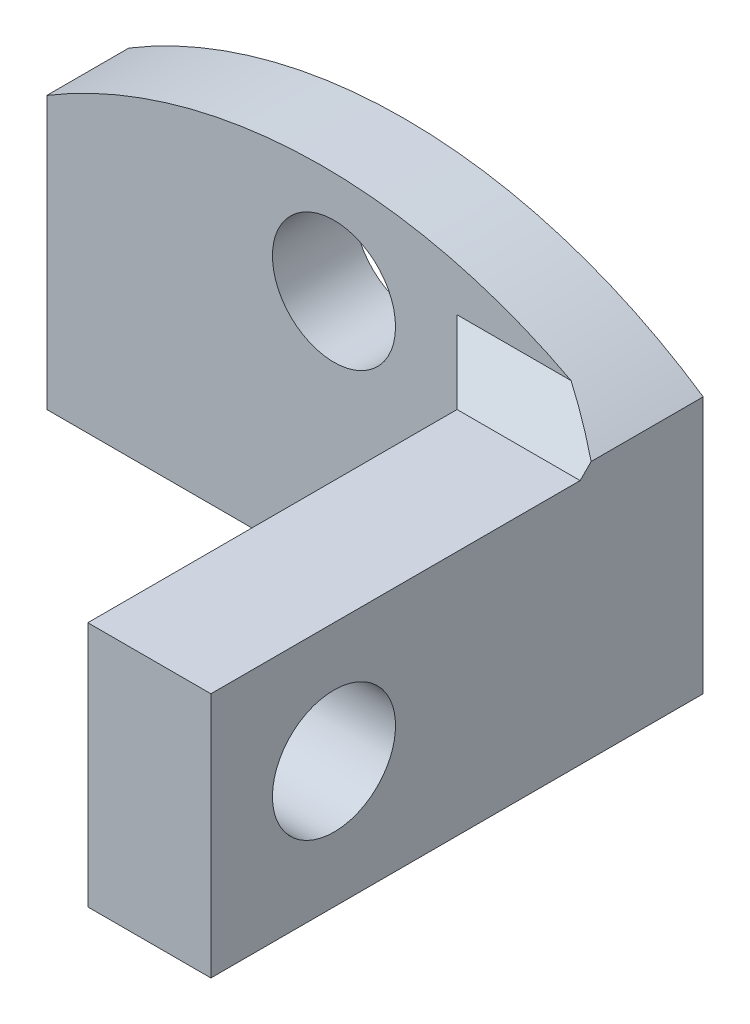
from build123d import *

# Parameters (mm, degrees)
SZKIC1_R                    = 1.5
DODANIE_WYCI_GNI_CIE1_DEPTH = 2
SZKIC2_W                    = 3
SZKIC2_H                    = 6
DODANIE_WYCI_GNI_CIE2_DEPTH = 10
SZKIC3_R                    = 1.5
WYTNIJ_WYCI_GNI_CIE1_DEPTH  = 3
SFAZOWANIE1_SIZE            = 1
SFAZOWANIE2_SIZE            = 1


with BuildPart() as part:
    # Szkic1 → Dodanie-wyciągnięcie1 (new body)
    with BuildSketch(Plane.XY):
        with BuildLine():
            Line((-6.716548808, 4.5), (7.283451192, 4.5))
            Line((7.283451192, 4.5), (7.283451192, 10.768070335))
            ThreePointArc((7.283451192, 10.768070335), (0.336426694, 12.995646082), (-6.716548808, 11.130497388))
            Line((-6.716548808, 11.130497388), (-6.716548808, 4.5))
        make_face()
        with Locations((0.283451192, 10.49617337)):
            Circle(SZKIC1_R, mode=Mode.SUBTRACT)
    extrude(amount=DODANIE_WYCI_GNI_CIE1_DEPTH)

    # Szkic2 → Dodanie-wyciągnięcie2 (add)
    with BuildSketch(Plane.XY.offset(2)):
        with Locations((5.783451192, 7.5)):
            Rectangle(SZKIC2_W, SZKIC2_H)
    extrude(amount=DODANIE_WYCI_GNI_CIE2_DEPTH)

    # Szkic3 → Wytnij-wyciągnięcie1 (cut)
    with BuildSketch(Plane.ZY.offset(-4.283451192)):
        with Locations((9, 7.579153313)):
            Circle(SZKIC3_R)
    extrude(amount=-WYTNIJ_WYCI_GNI_CIE1_DEPTH, mode=Mode.SUBTRACT)

    # Sfazowanie1
    sfazowanie1_edges = [part.edges().sort_by_distance(p)[0] for p in [
        (4.283451192, 7.5, 2),
    ]]
    chamfer(sfazowanie1_edges, length=SFAZOWANIE1_SIZE)

    # Sfazowanie2
    sfazowanie2_edges = [part.edges().sort_by_distance(p)[0] for p in [
        (5.283451192, 10.5, 2),
    ]]
    chamfer(sfazowanie2_edges, length=SFAZOWANIE2_SIZE)


solid = part.part
